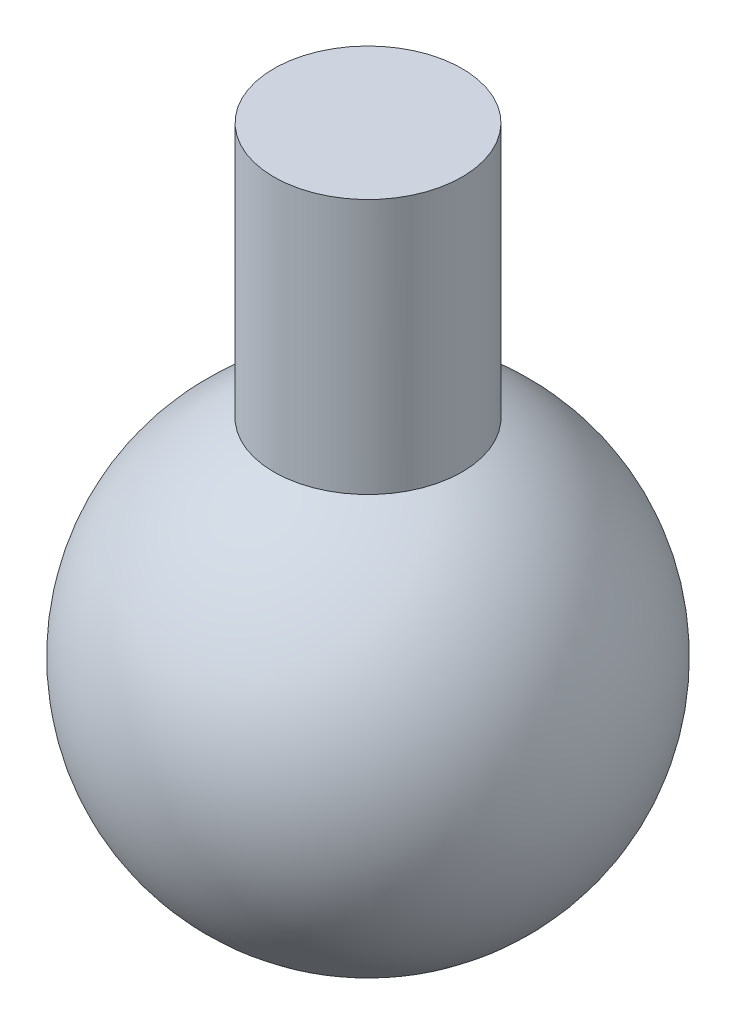
from build123d import *

# Parameters (mm, degrees)
BOSS_EXTRUDE1_DEPTH      = 30
BOSS_EXTRUDE1_DEPTH_BACK = 6
SKETCH2_R                = 12


with BuildPart() as part:
    # Sketch1 → Revolve1 (revolve)
    with BuildSketch(Plane(origin=(0, 0, 0), x_dir=(1, 0, 0), z_dir=(0, 1, 0))):
        with BuildLine():
            Line((0, -29), (0, 29))
            ThreePointArc((0, 29), (29, 0), (0, -29))
        make_face()
    revolve(axis=Axis((0, 0, 29), (0, 0, -1)))

    # Sketch2 → Boss-Extrude1 (add, two sides: drawn at the far end of the back side and taken through both)
    with BuildSketch(Plane(origin=(0, 29, 0), x_dir=(1, 0, 0), z_dir=(0, 1, 0)).offset(-BOSS_EXTRUDE1_DEPTH_BACK)):
        with Locations(Location((0, 0, 0), (0, 0, 270))):
            Circle(SKETCH2_R)
    extrude(amount=BOSS_EXTRUDE1_DEPTH + BOSS_EXTRUDE1_DEPTH_BACK)


solid = part.part
